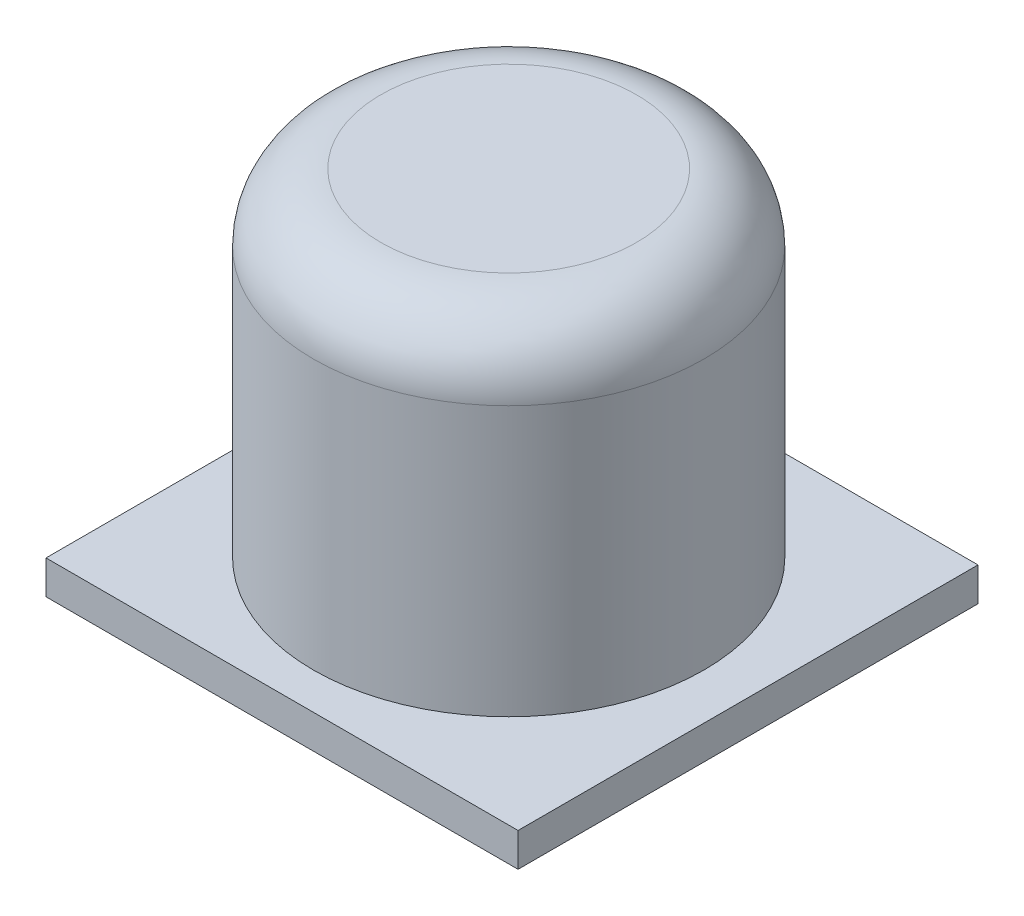
from build123d import *

# Parameters (mm, degrees)
SKETCH2_R           = 2.9
BOSS_EXTRUDE1_DEPTH = 0.5
BOSS_EXTRUDE2_START = 5
SKETCH3_R           = 2.9
BOSS_EXTRUDE2_DEPTH = 5
SKETCH4_W           = 7.010834482
SKETCH4_H           = 6.831005896
BOSS_EXTRUDE3_DEPTH = 0.5
FILLET1_R           = 1


with BuildPart() as part:
    # Sketch2 → Boss-Extrude1 (new body)
    with BuildSketch(Plane(origin=(0, 0, 0), x_dir=(1, 0, 0), z_dir=(0, 1, 0))):
        with Locations(Location((0, 0, 0), (0, 0, 270))):
            Circle(SKETCH2_R)
    extrude(amount=-BOSS_EXTRUDE1_DEPTH)

    # Sketch3 → Boss-Extrude2 (add)
    with BuildSketch(Plane(origin=(0, 0, 0), x_dir=(1, 0, 0), z_dir=(0, 1, 0)).offset(BOSS_EXTRUDE2_START)):
        with Locations(Location((0, 0, 0), (0, 0, 270))):
            Circle(SKETCH3_R)
    extrude(amount=-BOSS_EXTRUDE2_DEPTH)

    # Sketch4 → Boss-Extrude3 (add)
    with BuildSketch(Plane(origin=(0, 0, 0), x_dir=(1, 0, 0), z_dir=(0, 1, 0))):
        with Locations((0.077133625, -0.02775209)):
            Rectangle(SKETCH4_W, SKETCH4_H)
    extrude(amount=-BOSS_EXTRUDE3_DEPTH)

    # Fillet1
    fillet1_edges = [part.edges().sort_by_distance(p)[0] for p in [
        (0, 5, -2.9),
    ]]
    fillet(fillet1_edges, radius=FILLET1_R)


solid = part.part
